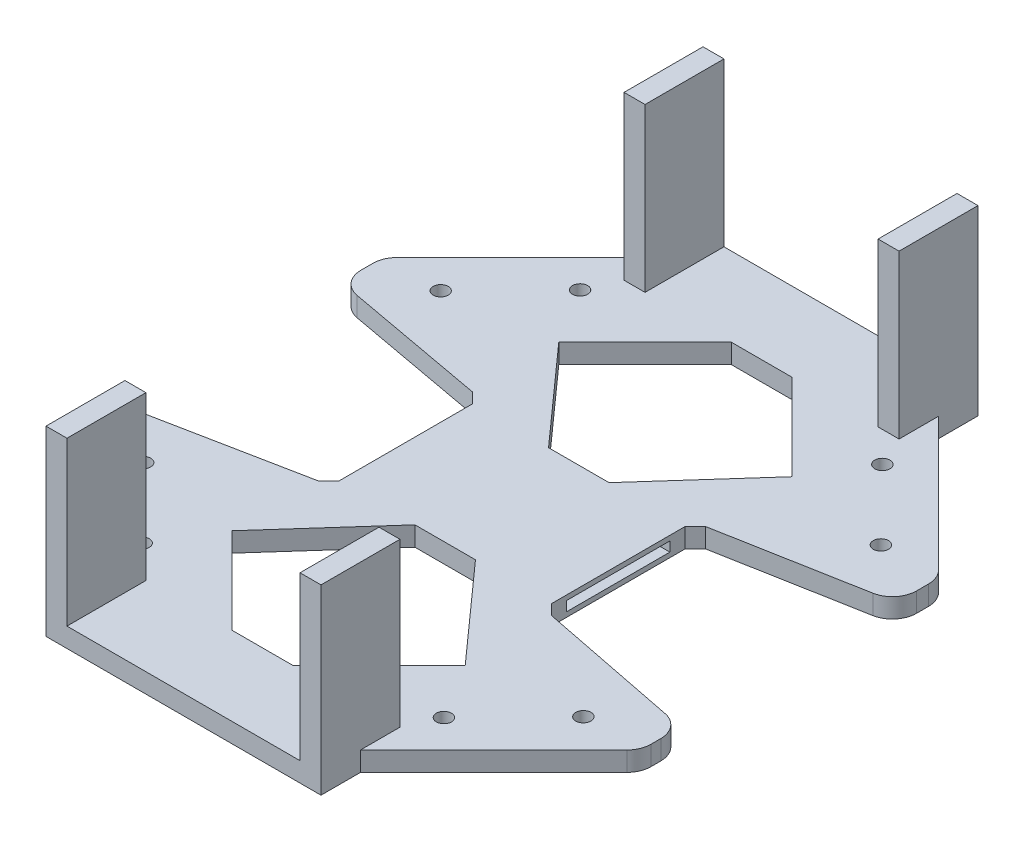
from build123d import *

# Parameters (mm, degrees)
SKETCH1_R           = 1.5875
BOSS_EXTRUDE2_DEPTH = 4.064
SKETCH3_W           = 21.59
SKETCH3_H           = 2.032
CUT_EXTRUDE1_DEPTH  = 140.966661307
SKETCH1_7_W         = 4.388124697
SKETCH1_7_H         = 16.51
BOSS_EXTRUDE3_DEPTH = 38.1
FILLET1_R           = 5.08
FILLET2_R           = 5.08
FILLET3_R           = 5.08


with BuildPart() as part:
    # Sketch1 → Boss-Extrude2 (new body)
    with BuildSketch(Plane(origin=(0, 0, 0), x_dir=(1, 0, 0), z_dir=(0, 1, 0))):
        Polygon((7.239, 61.9633), (9.3853, 59.817), (9.3853, 31.877), (7.239, 29.7307), (-26.486124697, 23.039223833), (-26.486124697, 14.732), (2.850875303, -14.605), (2.850875303, -22.86), (60.369724697, -22.86), (60.369724697, -14.605), (89.706724697, 14.732), (89.706724697, 23.039223833), (55.9816, 29.7307), (53.8353, 31.877), (53.8353, 59.817), (55.9816, 61.9633), (89.706724697, 68.150498918), (89.706724697, 76.962), (60.369724697, 106.299), (60.369724697, 114.554), (31.6103, 114.554), (2.850875303, 114.554), (2.850875303, 106.299), (-26.486124697, 76.962), (-26.486124697, 68.150498918), align=None)
        Polygon((25.27935, 59.817), (7.239, 80.00365), (25.27935, 98.044), (37.94125, 98.044), (55.9816, 80.00365), (37.94125, 59.817), align=None, mode=Mode.SUBTRACT)
        with Locations((0, 91.694)):
            Circle(SKETCH1_R, mode=Mode.SUBTRACT)
        with Locations((-14.4272, 76.962)):
            Circle(SKETCH1_R, mode=Mode.SUBTRACT)
        Polygon((25.27935, 31.877), (37.94125, 31.877), (55.9816, 11.69035), (37.94125, -6.35), (25.27935, -6.35), (7.239, 11.69035), align=None, mode=Mode.SUBTRACT)
        with Locations((63.2206, 91.694)):
            Circle(SKETCH1_R, mode=Mode.SUBTRACT)
        with Locations((77.6478, 76.962)):
            Circle(SKETCH1_R, mode=Mode.SUBTRACT)
        with Locations((77.6478, 14.732)):
            Circle(SKETCH1_R, mode=Mode.SUBTRACT)
        with Locations((63.2206, 0)):
            Circle(SKETCH1_R, mode=Mode.SUBTRACT)
        with Locations((-14.4272, 14.732)):
            Circle(SKETCH1_R, mode=Mode.SUBTRACT)
        Circle(SKETCH1_R, mode=Mode.SUBTRACT)
    extrude(amount=BOSS_EXTRUDE2_DEPTH)

    # Sketch3 → Cut-Extrude1 (cut, through all)
    with BuildSketch(Plane.ZY.offset(-9.3853)):
        with Locations((-45.847, 2.032)):
            Rectangle(SKETCH3_W, SKETCH3_H)
    extrude(amount=-CUT_EXTRUDE1_DEPTH, mode=Mode.SUBTRACT)

    # Sketch1<7> → Boss-Extrude3 (add)
    with BuildSketch(Plane(origin=(0, 0, 0), x_dir=(1, 0, 0), z_dir=(0, 1, 0))):
        with Locations((5.044937652, 106.299)):
            Rectangle(SKETCH1_7_W, SKETCH1_7_H)
        with Locations((58.175662348, 106.299)):
            Rectangle(SKETCH1_7_W, SKETCH1_7_H)
        with Locations((5.044937652, -14.605)):
            Rectangle(SKETCH1_7_W, SKETCH1_7_H)
        with Locations((58.175662348, -14.605)):
            Rectangle(SKETCH1_7_W, SKETCH1_7_H)
    extrude(amount=BOSS_EXTRUDE3_DEPTH)

    # Fillet1
    fillet1_edges = [part.edges().sort_by_distance(p)[0] for p in [
        (-26.486124697, 2.032, -76.962),
    ]]
    fillet(fillet1_edges, radius=FILLET1_R)

    # Fillet2
    fillet2_edges = [part.edges().sort_by_distance(p)[0] for p in [
        (-26.486124697, 2.032, -68.150498918),
    ]]
    fillet(fillet2_edges, radius=FILLET2_R)

    # Fillet3
    fillet3_edges = [part.edges().sort_by_distance(p)[0] for p in [
        (89.706724697, 2.032, -68.150498918),
        (89.706724697, 2.032, -76.962),
        (89.706724697, 2.032, -14.732),
        (89.706724697, 2.032, -23.039223833),
        (-26.486124697, 2.032, -14.732),
        (-26.486124697, 2.032, -23.039223833),
    ]]
    fillet(fillet3_edges, radius=FILLET3_R)


solid = part.part
